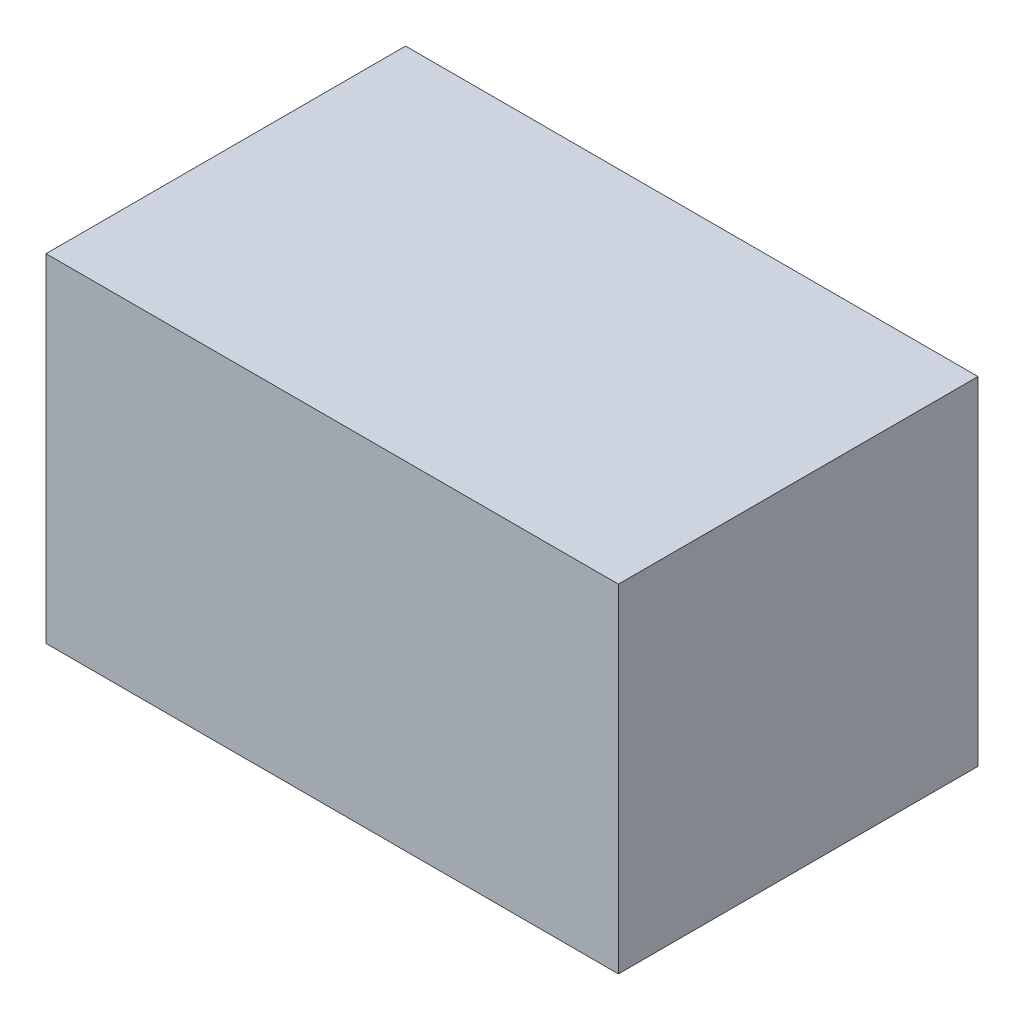
from build123d import *

# Parameters (mm, degrees)
SKETCH1_W           = 78
SKETCH1_H           = 46
BOSS_EXTRUDE1_DEPTH = 49


with BuildPart() as part:
    # Sketch1 → Boss-Extrude1 (new body)
    with BuildSketch(Plane.XY):
        Rectangle(SKETCH1_W, SKETCH1_H)
    extrude(amount=BOSS_EXTRUDE1_DEPTH)


solid = part.part
